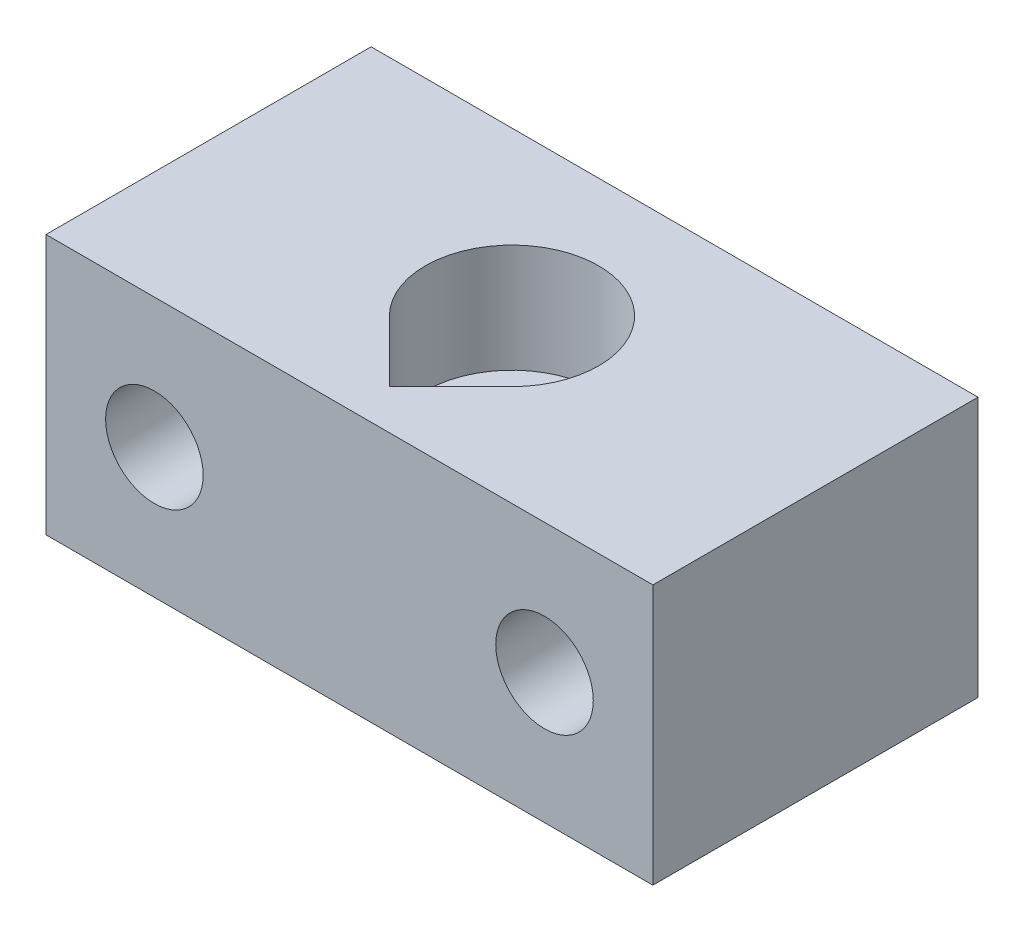
from build123d import *

# Parameters (mm, degrees)
SKETCH1_W           = 28
SKETCH1_H           = 30
BOSS_EXTRUDE1_DEPTH = 12
SKETCH2_R           = 2.25
CUT_EXTRUDE1_DEPTH  = 36.213633723
SKETCH4_W           = 28
SKETCH4_H           = 15
CUT_EXTRUDE3_DEPTH  = 24.769728648
CUT_EXTRUDE4_DEPTH  = 5


with BuildPart() as part:
    # Sketch1 → Boss-Extrude1 (new body)
    with BuildSketch(Plane(origin=(0, 0, 0), x_dir=(1, 0, 0), z_dir=(0, 1, 0))):
        Rectangle(SKETCH1_W, SKETCH1_H)
        with BuildLine():
            Line((-1.590990258, -9.090990258), (0, -10.681980515))
            Line((0, -10.681980515), (1.590990258, -9.090990258))
            ThreePointArc((1.590990258, -9.090990258), (0, -5.25), (-1.590990258, -9.090990258))
        make_face(mode=Mode.SUBTRACT)
        with BuildLine():
            Line((-1.590990258, 5.909009742), (0, 4.318019485))
            Line((0, 4.318019485), (1.590990258, 5.909009742))
            ThreePointArc((1.590990258, 5.909009742), (0, 9.75), (-1.590990258, 5.909009742))
        make_face(mode=Mode.SUBTRACT)
    extrude(amount=BOSS_EXTRUDE1_DEPTH)

    # Sketch2 → Cut-Extrude1 (cut, through all)
    with BuildSketch(Plane.XY.offset(15)):
        with Locations((-9, 6)):
            Circle(SKETCH2_R)
        with Locations((9, 6)):
            Circle(SKETCH2_R)
    extrude(amount=-CUT_EXTRUDE1_DEPTH, mode=Mode.SUBTRACT)

    # Sketch4 → Cut-Extrude3 (cut, through all)
    with BuildSketch(Plane(origin=(0, 12, 0), x_dir=(1, 0, 0), z_dir=(0, 1, 0))):
        with Locations((0, -7.5)):
            Rectangle(SKETCH4_W, SKETCH4_H)
    extrude(amount=-CUT_EXTRUDE3_DEPTH, mode=Mode.SUBTRACT)

    # Sketch5 → Cut-Extrude4 (cut)
    with BuildSketch(Plane(origin=(0, 12, 0), x_dir=(1, 0, 0), z_dir=(0, 1, 0))):
        with BuildLine():
            Line((-2.828427125, 4.671572875), (0, 1.843145751))
            Line((0, 1.843145751), (2.828427125, 4.671572875))
            ThreePointArc((2.828427125, 4.671572875), (0, 11.5), (-2.828427125, 4.671572875))
        make_face()
    extrude(amount=-CUT_EXTRUDE4_DEPTH, mode=Mode.SUBTRACT)


solid = part.part
